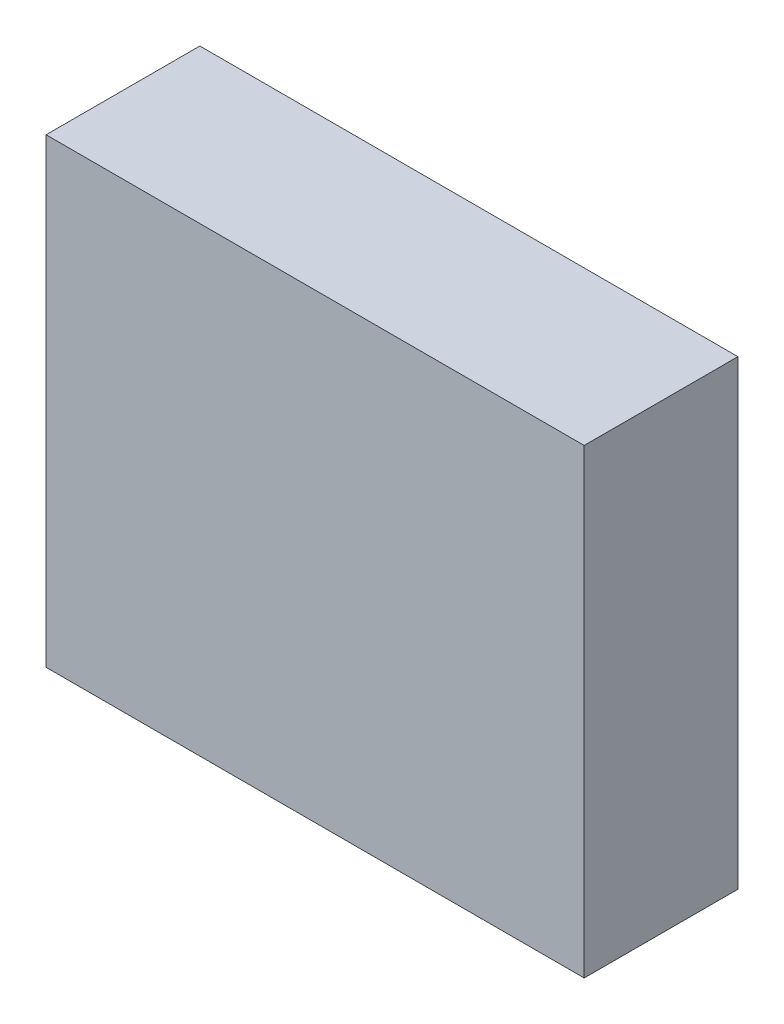
from build123d import *

# Parameters (mm, degrees)
SKETCH_1_W      = 70
SKETCH_1_H      = 60
EXTRUDE_1_DEPTH = 20


with BuildPart() as part:
    # 草图1 → 凸台-拉伸1 (new body)
    with BuildSketch(Plane.XY):
        Rectangle(SKETCH_1_W, SKETCH_1_H)
    extrude(amount=EXTRUDE_1_DEPTH)


solid = part.part
